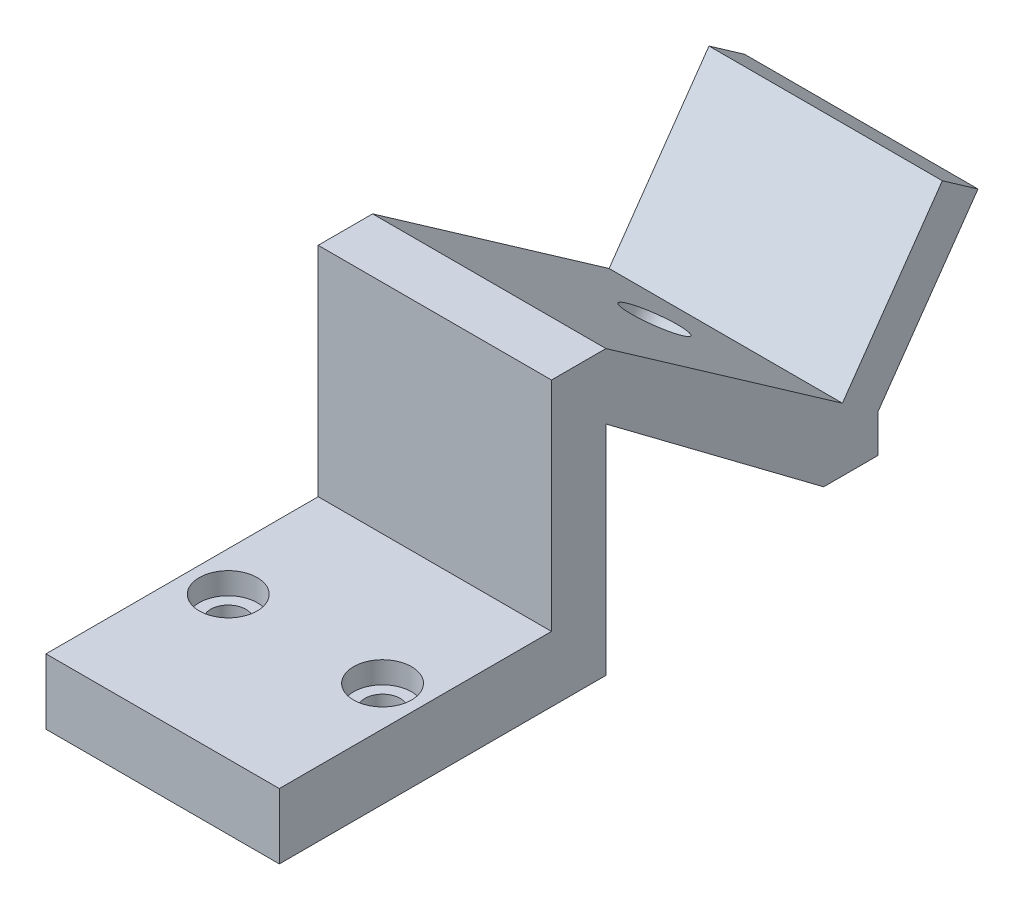
from build123d import *

# Parameters (mm, degrees)
SKETCH1_W           = 27.22
SKETCH1_H           = 50.8
BOSS_EXTRUDE1_DEPTH = 7.62
SKETCH2_R           = 2.05
CUT_EXTRUDE1_DEPTH  = 7.62
SKETCH3_R           = 3.3782
CUT_EXTRUDE2_DEPTH  = 2.54
SKETCH4_W           = 27.22
SKETCH4_H           = 19.05
BOSS_EXTRUDE2_DEPTH = 25.4
SKETCH5_W           = 27.22
SKETCH5_H           = 33.02
BOSS_EXTRUDE3_DEPTH = 25.4
SKETCH7_W           = 27.22
SKETCH7_H           = 6.35
CUT_EXTRUDE3_DEPTH  = 38.1
CUT_EXTRUDE4_DEPTH  = 27.94
CUT_EXTRUDE5_DEPTH  = 27.94
CUT_EXTRUDE6_DEPTH  = 27.94
SKETCH12_W          = 27.22
SKETCH12_H          = 5.08
BOSS_EXTRUDE5_DEPTH = 20.32
CUT_EXTRUDE8_DEPTH  = 12.7
SKETCH16_R          = 4.826
CUT_EXTRUDE9_DEPTH  = 2.54


with BuildPart() as part:
    # Sketch1 → Boss-Extrude1 (new body)
    with BuildSketch(Plane(origin=(0, 0, 0), x_dir=(1, 0, 0), z_dir=(0, 1, 0))):
        with Locations((-0.346834532, 16.982733813)):
            Rectangle(SKETCH1_W, SKETCH1_H)
    extrude(amount=BOSS_EXTRUDE1_DEPTH)

    # Sketch2 → Cut-Extrude1 (cut)
    with BuildSketch(Plane(origin=(0, 7.62, 0), x_dir=(1, 0, 0), z_dir=(0, 1, 0))):
        with Locations(Location((-9.346834532, 8.232733813, 0), (0, 0, 270))):
            Circle(SKETCH2_R)
    cut_extrude1 = extrude(amount=-CUT_EXTRUDE1_DEPTH, mode=Mode.SUBTRACT)

    # Sketch3 → Cut-Extrude2 (cut)
    with BuildSketch(Plane(origin=(0, 7.62, 0), x_dir=(1, 0, 0), z_dir=(0, 1, 0))):
        with Locations(Location((-9.346834532, 8.232733813, 0), (0, 0, 270))):
            Circle(SKETCH3_R)
    cut_extrude2 = extrude(amount=-CUT_EXTRUDE2_DEPTH, mode=Mode.SUBTRACT)

    # Mirror1: Cut-Extrude1, Cut-Extrude2 across plane
    add(cut_extrude1.mirror(Plane.ZY.offset(0.346834532)), mode=Mode.SUBTRACT)
    add(cut_extrude2.mirror(Plane.ZY.offset(0.346834532)), mode=Mode.SUBTRACT)

    # Sketch4 → Boss-Extrude2 (add)
    with BuildSketch(Plane(origin=(0, 7.62, 0), x_dir=(1, 0, 0), z_dir=(0, 1, 0))):
        with Locations((-0.346834532, 32.857733813)):
            Rectangle(SKETCH4_W, SKETCH4_H)
    extrude(amount=BOSS_EXTRUDE2_DEPTH)

    # Sketch5 → Boss-Extrude3 (add)
    with BuildSketch(Plane(origin=(0, 0, -42.382733813), x_dir=(-1, 0, 0), z_dir=(0, 0, -1))):
        with Locations((0.346834532, 16.51)):
            Rectangle(SKETCH5_W, SKETCH5_H)
    extrude(amount=BOSS_EXTRUDE3_DEPTH)

    # Sketch7 → Cut-Extrude3 (cut)
    with BuildSketch(Plane(origin=(0, 0, -67.782733813), x_dir=(-1, 0, 0), z_dir=(0, 0, -1))):
        with Locations((0.346834532, 3.175)):
            Rectangle(SKETCH7_W, SKETCH7_H)
    extrude(amount=-CUT_EXTRUDE3_DEPTH, mode=Mode.SUBTRACT)

    # Sketch8 → Cut-Extrude4 (cut)
    with BuildSketch(Plane.ZY.offset(13.956834532)):
        Polygon((-29.682733813, 6.35), (-29.682733813, 25.4), (-55.082733813, 6.35), align=None)
    extrude(amount=-CUT_EXTRUDE4_DEPTH, mode=Mode.SUBTRACT)

    # Sketch9 → Cut-Extrude5 (cut)
    with BuildSketch(Plane.ZY.offset(13.956834532)):
        Polygon((-67.782733813, 33.02), (-67.782733813, 6.35), (-29.682733813, 33.02), align=None)
    extrude(amount=-CUT_EXTRUDE5_DEPTH, mode=Mode.SUBTRACT)

    # Sketch11 → Cut-Extrude6 (cut)
    with BuildSketch(Plane.ZY.offset(13.956834532)):
        Polygon((-61.432733813, 6.35), (-61.432733813, 10.795), (-67.782733813, 6.35), align=None)
    extrude(amount=-CUT_EXTRUDE6_DEPTH, mode=Mode.SUBTRACT)

    # Sketch12 → Boss-Extrude5 (add)
    with BuildSketch(Plane(origin=(0, 36.105982328, -25.27418763), x_dir=(1, 0, 0), z_dir=(0, 0.8192319205190405, -0.5734623443633285))):
        with Locations((-0.346834532, 41.597130497)):
            Rectangle(SKETCH12_W, SKETCH12_H)
    extrude(amount=BOSS_EXTRUDE5_DEPTH)

    # Sketch15 → Cut-Extrude8 (cut)
    with BuildSketch(Plane(origin=(0, 36.105982328, -25.27418763), x_dir=(1, 0, 0), z_dir=(0, 0.8192319205190405, -0.5734623443633285))):
        with BuildLine():
            ThreePointArc((2.955165468, 28.897130497), (1.988032059, 31.231997088), (-0.346834532, 32.199130497))
            Line((-0.346834532, 32.199130497), (-0.346834532, 25.595130497))
            ThreePointArc((-0.346834532, 25.595130497), (1.988032059, 26.562263905), (2.955165468, 28.897130497))
        make_face()
        with BuildLine():
            Line((-0.346834532, 25.595130497), (-0.346834532, 32.199130497))
            ThreePointArc((-0.346834532, 32.199130497), (-3.648834532, 28.897130497), (-0.346834532, 25.595130497))
        make_face()
    extrude(amount=-CUT_EXTRUDE8_DEPTH, mode=Mode.SUBTRACT)

    # Sketch16 → Cut-Extrude9 (cut)
    with BuildSketch(Plane(origin=(0, 30.50371223, -22.877784173), x_dir=(1, 0, 0), z_dir=(0, -0.7999999999999999, 0.6000000000000003))):
        with Locations(Location((-0.346834532, -27.662506101, 0), (0, 0, 270))):
            Circle(SKETCH16_R)
    extrude(amount=-CUT_EXTRUDE9_DEPTH, mode=Mode.SUBTRACT)


solid = part.part
